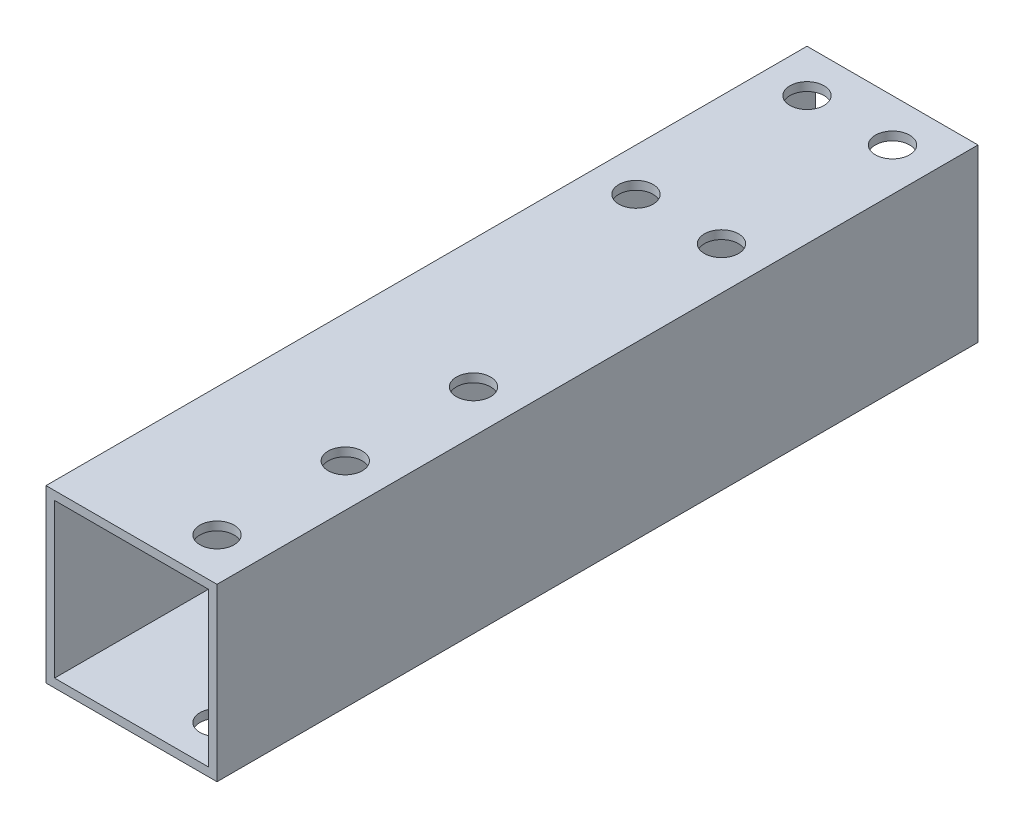
from build123d import *

# Parameters (mm, degrees)
SKETCH_1_W          = 20
SKETCH_1_H          = 20
SKETCH_1_W_2        = 18
SKETCH_1_H_2        = 18
EXTRUDE_1_DEPTH     = 89
SKETCH_2_R          = 2
CUT_EXTRUDE_1_DEPTH = 94.386294498


with BuildPart() as part:
    # 草图1 → 拉伸-薄壁1 (new body)
    with BuildSketch(Plane.XY):
        with Locations((10, 10)):
            Rectangle(SKETCH_1_W, SKETCH_1_H)
        with Locations((10, 10)):
            Rectangle(SKETCH_1_W_2, SKETCH_1_H_2, mode=Mode.SUBTRACT)
    extrude(amount=EXTRUDE_1_DEPTH)

    # 草图2 → 切除-拉伸1 (cut, through all)
    with BuildSketch(Plane(origin=(0, 20, 0), x_dir=(1, 0, 0), z_dir=(0, 1, 0))):
        with Locations(Location((5, -5, 0), (0, 0, 270))):
            Circle(SKETCH_2_R)
        with Locations(Location((15, -5, 0), (0, 0, 270))):
            Circle(SKETCH_2_R)
        with Locations(Location((5, -25, 0), (0, 0, 270))):
            Circle(SKETCH_2_R)
        with Locations(Location((15, -25, 0), (0, 0, 270))):
            Circle(SKETCH_2_R)
        with Locations(Location((15, -84, 0), (0, 0, 270))):
            Circle(SKETCH_2_R)
        with Locations(Location((15, -69, 0), (0, 0, 270))):
            Circle(SKETCH_2_R)
        with Locations(Location((15, -54, 0), (0, 0, 270))):
            Circle(SKETCH_2_R)
    extrude(amount=-CUT_EXTRUDE_1_DEPTH, mode=Mode.SUBTRACT)


solid = part.part
